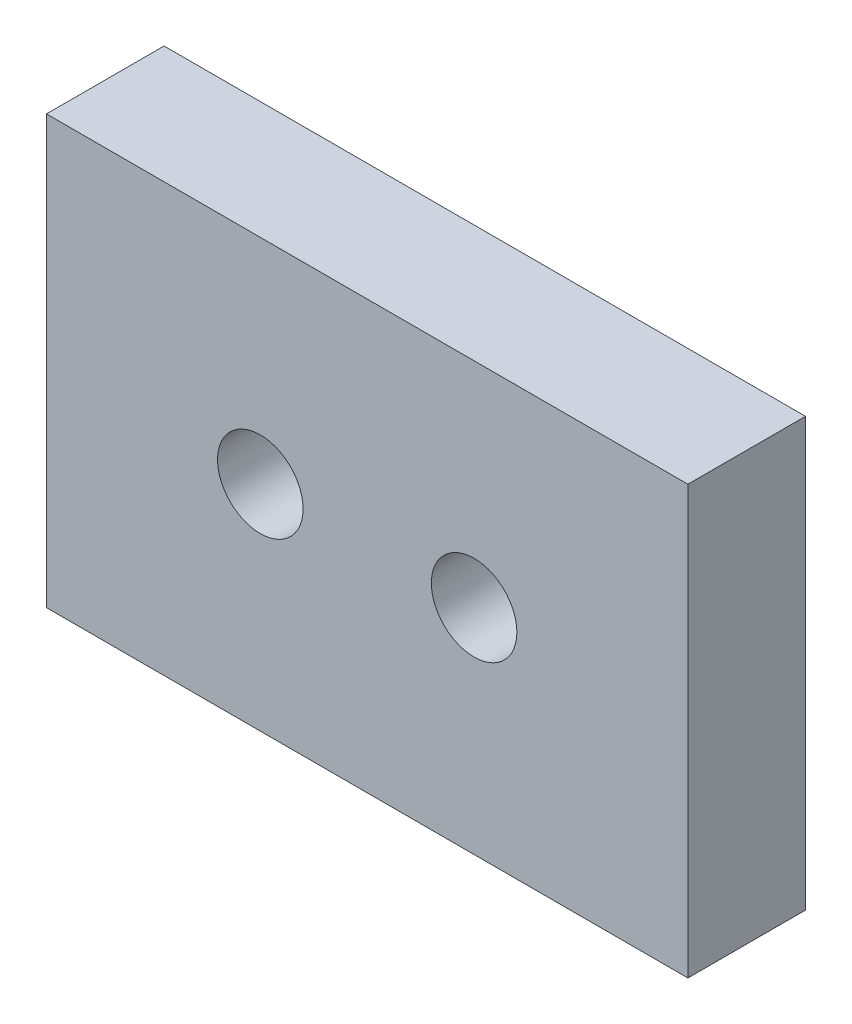
from build123d import *

# Parameters (mm, degrees)
SKETCH1_W           = 60
SKETCH1_H           = 40
SKETCH1_R           = 4
BOSS_EXTRUDE1_DEPTH = 11


with BuildPart() as part:
    # Sketch1 → Boss-Extrude1 (new body)
    with BuildSketch(Plane.XY):
        Rectangle(SKETCH1_W, SKETCH1_H)
        with Locations((-10, 0)):
            Circle(SKETCH1_R, mode=Mode.SUBTRACT)
        with Locations((10, 0)):
            Circle(SKETCH1_R, mode=Mode.SUBTRACT)
    extrude(amount=BOSS_EXTRUDE1_DEPTH)


solid = part.part
